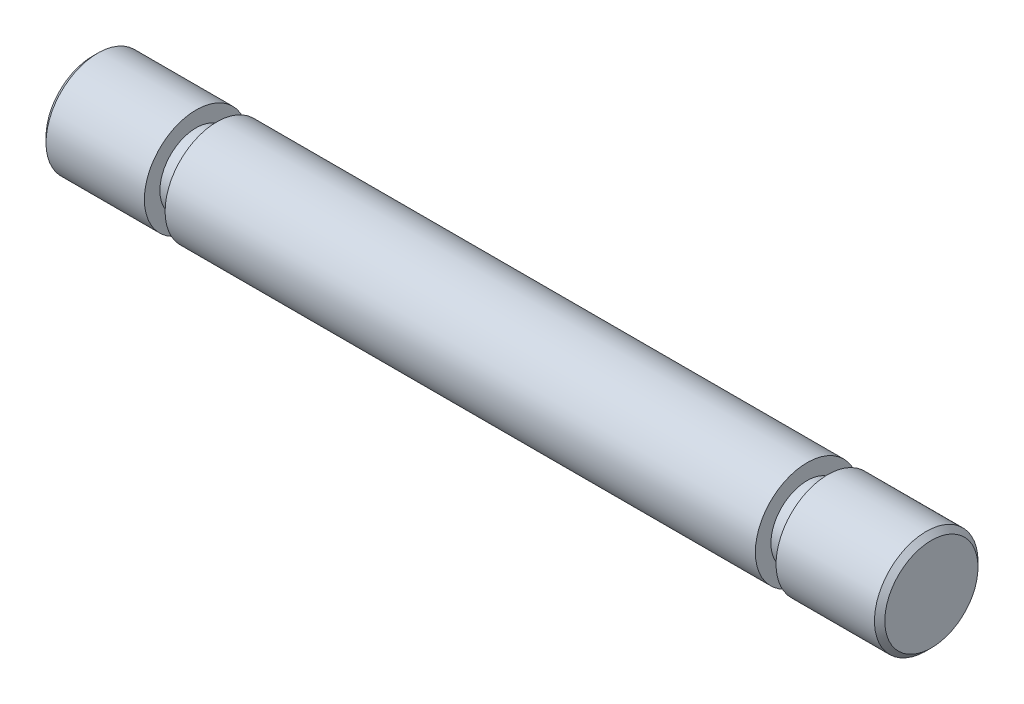
from build123d import *

# Parameters (mm, degrees)
SKETCH_4_R      = 5
EXTRUDE_4_DEPTH = 57
SKETCH_5_R      = 3.5
EXTRUDE_5_DEPTH = 2
EXTRUDE_START   = 10
SKETCH_6_R      = 5
EXTRUDE_6_DEPTH = 10
EXTRUDE_START_2 = 2
SKETCH_7_R      = 3.5
EXTRUDE_7_DEPTH = 2
SKETCH_8_R      = 5
EXTRUDE_8_DEPTH = 10
CHAMFER_1_SIZE  = 0.5


with BuildPart() as part:
    # 草图4 → 凸台-拉伸4 (new body)
    with BuildSketch(Plane(origin=(0, 0, 0), x_dir=(0, 0, -1), z_dir=(1, 0, 0))):
        with Locations(Location((0, 0, 0), (0, 0, 180))):
            Circle(SKETCH_4_R)
    extrude(amount=EXTRUDE_4_DEPTH)

    # 草图5 → 凸台-拉伸5 (add)
    with BuildSketch(Plane.ZY):
        Circle(SKETCH_5_R)
    extrude(amount=EXTRUDE_5_DEPTH)

    # 草图6 → 凸台-拉伸6 (add)
    with BuildSketch(Plane.ZY.offset(2).offset(EXTRUDE_START)):
        Circle(SKETCH_6_R)
    extrude(amount=-EXTRUDE_6_DEPTH)

    # 草图7 → 凸台-拉伸7 (add)
    with BuildSketch(Plane(origin=(57, 0, 0), x_dir=(0, 0, -1), z_dir=(1, 0, 0)).offset(EXTRUDE_START_2)):
        with Locations(Location((0, 0, 0), (0, 0, 180))):
            Circle(SKETCH_7_R)
    extrude(amount=-EXTRUDE_7_DEPTH)

    # 草图8 → 凸台-拉伸8 (add)
    with BuildSketch(Plane(origin=(59, 0, 0), x_dir=(0, 0, -1), z_dir=(1, 0, 0))):
        with Locations(Location((0, 0, 0), (0, 0, 180))):
            Circle(SKETCH_8_R)
    extrude(amount=EXTRUDE_8_DEPTH)

    # 倒角1
    chamfer_1_edges = [part.edges().sort_by_distance(p)[0] for p in [
        (-12, 0, -5),
        (69, 0, -5),
    ]]
    chamfer(chamfer_1_edges, length=CHAMFER_1_SIZE)


solid = part.part
